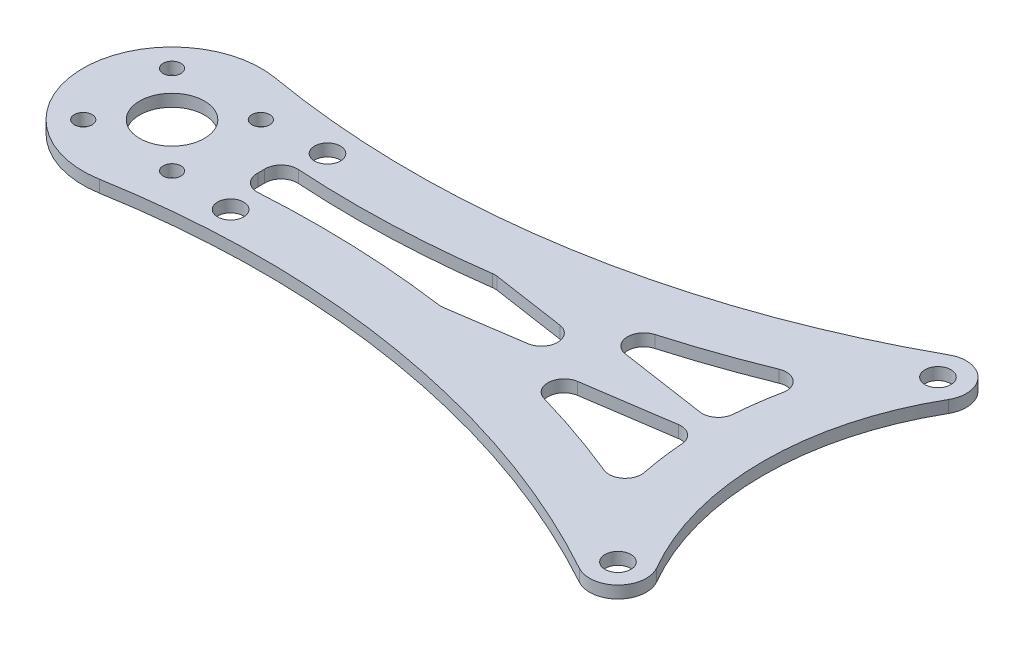
from build123d import *

# Parameters (mm, degrees)
SKETCH1_R                      = 3.5
BOSS_EXTRUDE1_DEPTH            = 0.75
F_2_2_2_2_DIAMETER_HOLE1_D     = 2.2
F_3_2_3_2_DIAMETER_HOLE1_D     = 3.2
F_3_2_3_2_DIAMETER_HOLE1_DEPTH = 10
F_3_2_3_2_DIAMETER_HOLE1_TIP   = 0.96137699
CUT_EXTRUDE1_DEPTH             = 123.2407972
FILLET1_R                      = 2
SKETCH7_R                      = 4
CUT_EXTRUDE2_DEPTH             = 123.240797318


with BuildPart() as part:
    # Sketch1 → Boss-Extrude1 (new, symmetric)
    with BuildSketch(Plane(origin=(0, 0, 0), x_dir=(1, 0, 0), z_dir=(0, 1, 0))):
        with BuildLine():
            ThreePointArc((-37.239092363, -21.5), (-43, 0), (-37.239092363, 21.5))
            ThreePointArc((-37.239092363, 21.5), (-36.658838331, 22.248681329), (-35.899079455, 22.81435343))
            ThreePointArc((-35.899079455, 22.81435343), (-70.492179883, 10.7556392), (-107.126701642, 10.839315166))
            ThreePointArc((-107.126701642, 10.839315166), (-120, 0), (-107.126701642, -10.839315166))
            ThreePointArc((-107.126701642, -10.839315166), (-70.492179883, -10.7556392), (-35.899079455, -22.81435343))
            ThreePointArc((-35.899079455, -22.81435343), (-36.658838331, -22.248681329), (-37.239092363, -21.5))
        make_face()
        with BuildLine():
            ThreePointArc((-31.176914536, 18), (-35.958003449, 16.718911087), (-37.239092363, 21.5))
            ThreePointArc((-37.239092363, 21.5), (-43, 0), (-37.239092363, -21.5))
            ThreePointArc((-37.239092363, -21.5), (-35.958003449, -16.718911087), (-31.176914536, -18))
            ThreePointArc((-31.176914536, -18), (-36, 0), (-31.176914536, 18))
        make_face()
        with Locations((-34.208003449, -19.75)):
            Circle(SKETCH1_R)
        with Locations((-34.208003449, 19.75)):
            Circle(SKETCH1_R)
    extrude(amount=BOSS_EXTRUDE1_DEPTH, both=True)

    # Ø2.2 (2.2) Diameter Hole1 (through all)
    with Locations(Plane(origin=(0, 0.75, 0), x_dir=(1, 0, 0), z_dir=(0, 1, 0))):
        with Locations((-114.480077554, 5.480077554), (-103.519922446, 5.480077554), (-103.519922446, -5.480077554), (-114.480077554, -5.480077554)):
            Hole(F_2_2_2_2_DIAMETER_HOLE1_D / 2)

    # Ø3.2 (3.2) Diameter Hole1
    with Locations(Plane(origin=(0, 0.75, 0), x_dir=(1, 0, 0), z_dir=(0, 1, 0))):
        with Locations((-34.208003449, 19.75), (-34.208003449, -19.75), (-95.790276336, 5.979398024), (-95.790276336, -5.979398024)):
            Hole(F_3_2_3_2_DIAMETER_HOLE1_D / 2, depth=F_3_2_3_2_DIAMETER_HOLE1_DEPTH)
            with Locations((0, 0, -(F_3_2_3_2_DIAMETER_HOLE1_DEPTH + F_3_2_3_2_DIAMETER_HOLE1_TIP / 2))):  # 118° drill point
                Cone(0, F_3_2_3_2_DIAMETER_HOLE1_D / 2, F_3_2_3_2_DIAMETER_HOLE1_TIP, mode=Mode.SUBTRACT)

    # Sketch6 → Cut-Extrude1 (cut, through all)
    with BuildSketch(Plane(origin=(0, 0.75, 0), x_dir=(1, 0, 0), z_dir=(0, 1, 0))):
        with BuildLine():
            Line((-72.469338063, -3.369046694), (-49.802019621, 0))
            Line((-49.802019621, 0), (-72.469338063, 3.369046694))
            ThreePointArc((-72.469338063, 3.369046694), (-85.377857375, 2.290839769), (-98.326107181, 2.65857332))
            ThreePointArc((-98.326107181, 2.65857332), (-98, 0), (-98.326107181, -2.65857332))
            ThreePointArc((-98.326107181, -2.65857332), (-85.377857375, -2.290839769), (-72.469338063, -3.369046694))
        make_face()
        with BuildLine():
            Line((-66.096117167, 4.443764231), (-42.988154947, 1.009224591))
            ThreePointArc((-42.988154947, 1.009224591), (-42.467311238, 6.747405149), (-41.183985346, 12.36443897))
            ThreePointArc((-41.183985346, 12.36443897), (-53.416219701, 7.70010587), (-66.096117167, 4.443764231))
        make_face()
        with BuildLine():
            ThreePointArc((-41.183985346, -12.36443897), (-42.467311238, -6.747405149), (-42.988154947, -1.009224591))
            Line((-42.988154947, -1.009224591), (-66.096117167, -4.443764231))
            ThreePointArc((-66.096117167, -4.443764231), (-53.416219701, -7.70010587), (-41.183985346, -12.36443897))
        make_face()
    extrude(amount=-CUT_EXTRUDE1_DEPTH, mode=Mode.SUBTRACT)

    # Fillet1
    fillet1_edges = [part.edges().sort_by_distance(p)[0] for p in [
        (-42.988154947, 0, 1.009224591),
        (-41.183985346, 0, 12.36443897),
        (-66.096117167, 0, 4.443764231),
        (-98.326107181, 0, 2.65857332),
        (-98.326107181, 0, -2.65857332),
        (-72.469338063, 0, -3.369046694),
        (-49.802019621, 0, 0),
        (-72.469338063, 0, 3.369046694),
        (-41.183985346, 0, -12.36443897),
        (-42.988154947, 0, -1.009224591),
        (-66.096117167, 0, -4.443764231),
    ]]
    fillet(fillet1_edges, radius=FILLET1_R)

    # Sketch7 → Cut-Extrude2 (cut, through all)
    with BuildSketch(Plane(origin=(0, 0.75, 0), x_dir=(1, 0, 0), z_dir=(0, 1, 0))):
        with Locations(Location((-109, 0, 0), (0, 0, 270))):
            Circle(SKETCH7_R)
    extrude(amount=-CUT_EXTRUDE2_DEPTH, mode=Mode.SUBTRACT)


solid = part.part
